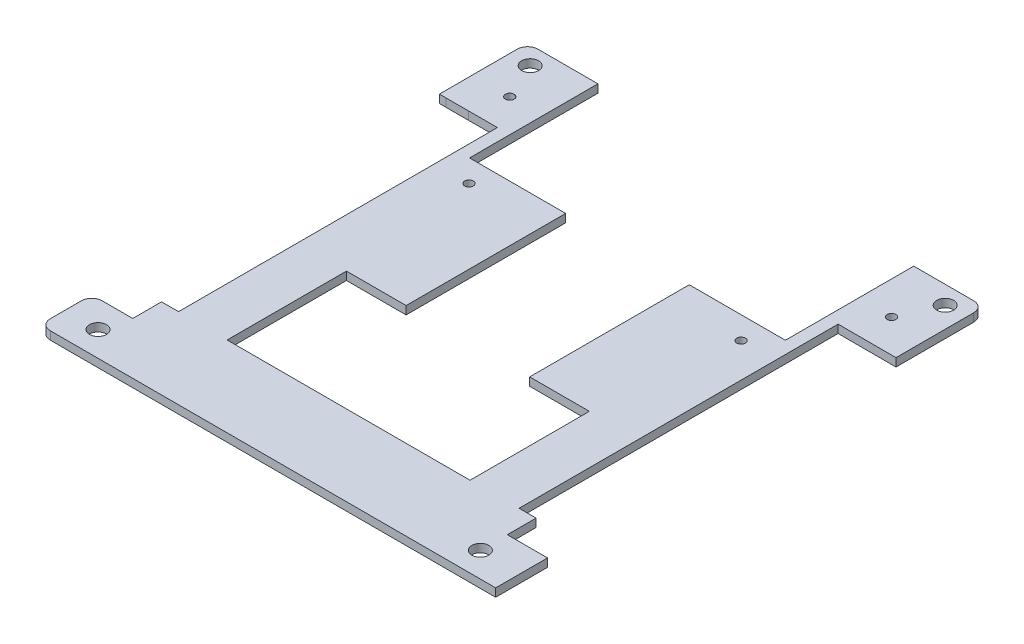
from build123d import *

# Parameters (mm, degrees)
SKETCH1_R           = 1.6383
SKETCH1_R_2         = 0.8382
BOSS_EXTRUDE1_DEPTH = 1.575


with BuildPart() as part:
    # Sketch1 → Boss-Extrude1 (new body)
    with BuildSketch(Plane(origin=(0, 0, 0), x_dir=(1, 0, 0), z_dir=(0, 1, 0))):
        with BuildLine():
            Line((-38.39500299, 29.999999735), (-42.73000299, 29.999999735))
            Line((-42.73000299, 29.999999735), (-44.000003042, 30.013999735))
            Line((-44.000003042, 30.013999735), (-44.000003042, 31.269999735))
            Line((-44.000003042, 31.269999735), (-44.00000361, 44.999999735))
            ThreePointArc((-44.00000361, 44.999999735), (-43.414217128, 46.414213903), (-42.000002924, 47.000000297))
            Line((-42.000002924, 47.000000297), (-30.435003745, 47.000000297))
            Line((-30.435003745, 47.000000297), (-30.435002721, 22.255354587))
            Line((-30.435002721, 22.255354587), (-11.909002721, 22.255355354))
            Line((-11.909002721, 22.255355354), (-11.909002721, -8.5))
            Line((-11.909002721, -8.5), (-23.409001447, -8.5))
            Line((-23.409001447, -8.5), (-23.409000495, -31.499999412))
            Line((-23.409000495, -31.499999412), (23.408999505, -31.499997474))
            Line((23.408999505, -31.499997474), (23.408999505, -8.499997555))
            Line((23.408999505, -8.499997555), (11.908997279, -8.499997555))
            Line((11.908997279, -8.499997555), (11.908997279, 22.25535634))
            Line((11.908997279, 22.25535634), (30.434997279, 22.255357107))
            Line((30.434997279, 22.255357107), (30.434996255, 47.000002817))
            Line((30.434996255, 47.000002817), (41.999997246, 47.000002817))
            ThreePointArc((41.999997246, 47.000002817), (43.414210615, 46.414216484), (43.999996958, 45.000003119))
            Line((43.999996958, 45.000003119), (43.999996958, 32.000003378))
            Line((43.999996958, 32.000003378), (43.999996958, 30.014003378))
            Line((43.999996958, 30.014003378), (32.823996958, 30.032002916))
            Line((32.823996958, 30.032002916), (32.823999503, -31.453997084))
            Line((32.823999503, -31.453997084), (36.099999555, -31.453996949))
            Line((36.099999555, -31.453996949), (36.099999785, -36.999996949))
            Line((36.099999785, -36.999996949), (43.849731264, -36.999996949))
            Line((43.849731264, -36.999996949), (43.849731264, -46.999996628))
            Line((43.849731264, -46.999996628), (-42.000000215, -46.999996628))
            ThreePointArc((-42.000000215, -46.999996628), (-43.414212607, -46.414211361), (-44.000000215, -44.999999938))
            Line((-44.000000215, -44.999999938), (-44.000000215, -38.976999938))
            ThreePointArc((-44.000000215, -38.976999938), (-43.409460005, -37.574276579), (-42.000000215, -36.999999938))
            Line((-42.000000215, -36.999999938), (-38.395000215, -36.999999938))
            Line((-38.395000215, -36.999999938), (-36.100000319, -36.999999938))
            Line((-36.100000319, -36.999999938), (-36.100000549, -31.453999938))
            Line((-36.100000549, -31.453999938), (-32.824000497, -31.453999802))
            Line((-32.824000497, -31.453999802), (-32.824003042, 30.014000198))
            Line((-32.824003042, 30.014000198), (-38.39500299, 29.999999735))
        make_face()
        with Locations(Location((40, 43.5, 0), (0, 0, 270))):
            Circle(SKETCH1_R, mode=Mode.SUBTRACT)
        with Locations(Location((-40, 43.5, 0), (0, 0, 270))):
            Circle(SKETCH1_R, mode=Mode.SUBTRACT)
        with Locations(Location((-37.6, -42.2, 0), (0, 0, 270))):
            Circle(SKETCH1_R, mode=Mode.SUBTRACT)
        with Locations(Location((36.1, -42.2, 0), (0, 0, 270))):
            Circle(SKETCH1_R, mode=Mode.SUBTRACT)
        with Locations(Location((-36.785003304, 36.350000034, 0), (0, 0, 270))):
            Circle(SKETCH1_R_2, mode=Mode.SUBTRACT)
        with Locations(Location((-26.220002542, 17.93192918, 0), (0, 0, 270))):
            Circle(SKETCH1_R_2, mode=Mode.SUBTRACT)
        with Locations(Location((26.219997458, 17.931931351, 0), (0, 0, 270))):
            Circle(SKETCH1_R_2, mode=Mode.SUBTRACT)
        with Locations(Location((36.784996695, 36.36800308, 0), (0, 0, 270))):
            Circle(SKETCH1_R_2, mode=Mode.SUBTRACT)
    extrude(amount=BOSS_EXTRUDE1_DEPTH)


solid = part.part
